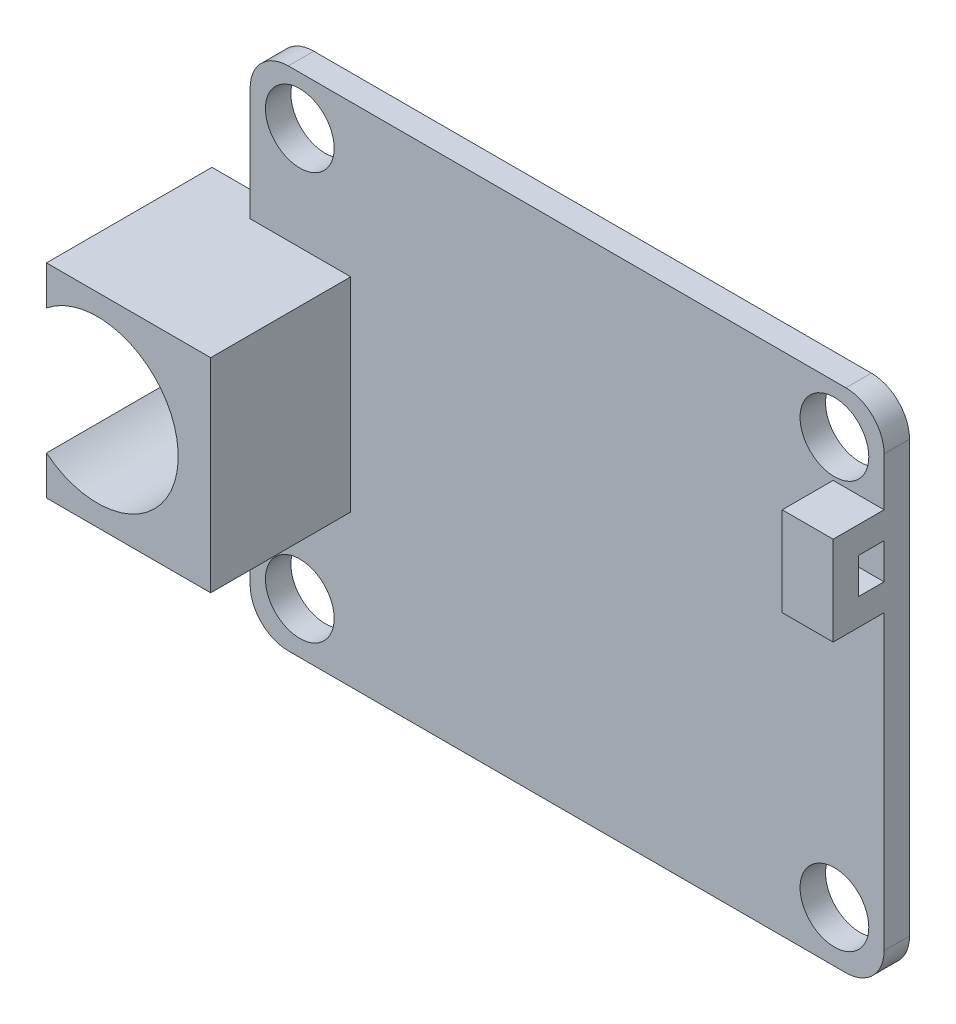
from build123d import *

# Parameters (mm, degrees)
CROQUIS1_W              = 49.8
CROQUIS1_H              = 39.8
CROQUIS1_R              = 2.7
SALIENTE_EXTRUIR1_DEPTH = 6
CORTAR_EXTRUIR1_DEPTH   = 4
REDONDEO1_R             = 3
SALIENTE_EXTRUIR3_DEPTH = 3
CROQUIS5_R              = 6.35
CORTAR_EXTRUIR2_DEPTH   = 3
SALIENTE_EXTRUIR4_DEPTH = 10
SALIENTE_EXTRUIR5_DEPTH = 2
CORTAR_EXTRUIR3_START   = -3
CORTAR_EXTRUIR3_DEPTH   = 3
CORTAR_EXTRUIR4_DEPTH   = 4
CROQUIS10_W             = 4
CROQUIS10_H             = 7
SALIENTE_EXTRUIR6_DEPTH = 4
CORTAR_EXTRUIR5_START   = -4
CORTAR_EXTRUIR5_DEPTH   = 4


with BuildPart() as part:
    # Croquis1 → Saliente-Extruir1 (new body)
    with BuildSketch(Plane.XY):
        with Locations((-31.963412372, -3.757931034)):
            Rectangle(CROQUIS1_W, CROQUIS1_H)
        with Locations((-52.963412372, 12.342068966)):
            Circle(CROQUIS1_R, mode=Mode.SUBTRACT)
        with Locations((-10.963412372, 12.342068966)):
            Circle(CROQUIS1_R, mode=Mode.SUBTRACT)
        with Locations((-10.963412372, -19.657931034)):
            Circle(CROQUIS1_R, mode=Mode.SUBTRACT)
        with Locations((-52.963412372, -19.657931034)):
            Circle(CROQUIS1_R, mode=Mode.SUBTRACT)
    extrude(amount=SALIENTE_EXTRUIR1_DEPTH)

    # Croquis2 → Cortar-Extruir1 (cut)
    with BuildSketch(Plane.XY.offset(6)):
        with BuildLine():
            Line((-49.963412372, -16.757931034), (-13.963412372, -16.757931034))
            ThreePointArc((-13.963412372, -16.757931034), (-12.54919881, -16.172144597), (-11.963412372, -14.757931034))
            Line((-11.963412372, -14.757931034), (-11.963412372, 7.242068966))
            ThreePointArc((-11.963412372, 7.242068966), (-12.54919881, 8.656282528), (-13.963412372, 9.242068966))
            Line((-13.963412372, 9.242068966), (-49.963412372, 9.242068966))
            ThreePointArc((-49.963412372, 9.242068966), (-51.377625934, 8.656282528), (-51.963412372, 7.242068966))
            Line((-51.963412372, 7.242068966), (-51.963412372, -14.757931034))
            ThreePointArc((-51.963412372, -14.757931034), (-51.377625934, -16.172144597), (-49.963412372, -16.757931034))
        make_face()
    extrude(amount=-CORTAR_EXTRUIR1_DEPTH, mode=Mode.SUBTRACT)

    # Redondeo1
    redondeo1_edges = [part.edges().sort_by_distance(p)[0] for p in [
        (-56.863412372, 16.142068966, 3),
        (-7.063412372, 16.142068966, 3),
        (-7.063412372, -23.657931034, 3),
        (-56.863412372, -23.657931034, 3),
    ]]
    fillet(redondeo1_edges, radius=REDONDEO1_R)

    # Croquis4 → Saliente-Extruir3 (add)
    with BuildSketch(Plane(origin=(0, 0, 0), x_dir=(-1, 0, 0), z_dir=(0, 0, -1))):
        with BuildLine():
            Line((56.863412372, 4.242068966), (61.863412372, 4.242068966))
            Line((61.863412372, 4.242068966), (61.863412372, -0.257931034))
            Line((61.863412372, -0.257931034), (57.863412372, -0.257931034))
            ThreePointArc((57.863412372, -0.257931034), (57.358118834, -0.294597605), (56.863412372, -0.403829068))
            Line((56.863412372, -0.403829068), (56.863412372, 4.242068966))
        make_face()
        with BuildLine():
            Line((61.863412372, -11.757931034), (56.863412372, -11.757931034))
            Line((56.863412372, -11.757931034), (56.863412372, -7.112033001))
            ThreePointArc((56.863412372, -7.112033001), (57.358118834, -7.221264464), (57.863412372, -7.257931034))
            Line((57.863412372, -7.257931034), (61.863412372, -7.257931034))
            Line((61.863412372, -7.257931034), (61.863412372, -11.757931034))
        make_face()
    extrude(amount=-SALIENTE_EXTRUIR3_DEPTH)

    # Croquis5 → Cortar-Extruir2 (cut)
    with BuildSketch(Plane.XY.offset(3)):
        with Locations((-57.863412372, -3.757931034)):
            Circle(CROQUIS5_R)
    extrude(amount=CORTAR_EXTRUIR2_DEPTH, mode=Mode.SUBTRACT)

    # Croquis6 → Saliente-Extruir4 (add)
    with BuildSketch(Plane.XY.offset(3)):
        with BuildLine():
            Line((-61.863412372, 4.242068966), (-51.963412372, 4.242068966))
            Line((-51.963412372, 4.242068966), (-48.963412372, 4.242068966))
            Line((-48.963412372, 4.242068966), (-48.963412372, -11.757931034))
            Line((-48.963412372, -11.757931034), (-51.963412372, -11.757931034))
            Line((-51.963412372, -11.757931034), (-61.863412372, -11.757931034))
            Line((-61.863412372, -11.757931034), (-61.863412372, -8.689715701))
            ThreePointArc((-61.863412372, -8.689715701), (-51.513412372, -3.757931034), (-61.863412372, 1.173853632))
            Line((-61.863412372, 1.173853632), (-61.863412372, 4.242068966))
        make_face()
    extrude(amount=SALIENTE_EXTRUIR4_DEPTH)

    # Croquis7 → Saliente-Extruir5 (add)
    with BuildSketch(Plane.XY.offset(2)):
        Polygon((-51.963412372, -3.757931034), (-51.963412372, 4.242068966), (-48.963412372, 4.242068966), (-48.963412372, -11.757931034), (-51.963412372, -11.757931034), align=None)
    extrude(amount=SALIENTE_EXTRUIR5_DEPTH)

    # Croquis8 → Cortar-Extruir3 (cut)
    with BuildSketch(Plane.XY.offset(3).offset(CORTAR_EXTRUIR3_START)):
        with BuildLine():
            Line((-56.863412372, -0.403829068), (-56.863412372, -7.112033001))
            ThreePointArc((-56.863412372, -7.112033001), (-53.509310406, -3.757931034), (-56.863412372, -0.403829068))
        make_face()
    extrude(amount=CORTAR_EXTRUIR3_DEPTH, mode=Mode.SUBTRACT)

    # Croquis9 → Cortar-Extruir4 (cut)
    with BuildSketch(Plane.XY.offset(6)):
        Polygon((-56.863412372, -11.757931034), (-56.863412372, -27.492217147), (-1.817084798, -27.492217147), (-1.817084798, 22.861833321), (-56.863412372, 22.861833321), (-56.863412372, 4.242068966), (-47.172737702, 4.242068966), (-47.172737702, -11.757931034), align=None)
    extrude(amount=-CORTAR_EXTRUIR4_DEPTH, mode=Mode.SUBTRACT)

    # Croquis10 → Saliente-Extruir6 (add)
    with BuildSketch(Plane.XY.offset(2)):
        with Locations((-9.063412372, 5.842068966)):
            Rectangle(CROQUIS10_W, CROQUIS10_H)
    extrude(amount=SALIENTE_EXTRUIR6_DEPTH)

    # Croquis11 → Cortar-Extruir5 (cut)
    with BuildSketch(Plane(origin=(-7.063412372, 0, 0), x_dir=(0, 0, -1), z_dir=(1, 0, 0)).offset(CORTAR_EXTRUIR5_START)):
        Polygon((-2, 5.842068966), (-2, 7.242068966), (-4, 7.242068966), (-4, 4.442068966), (-2, 4.442068966), align=None)
    extrude(amount=CORTAR_EXTRUIR5_DEPTH, mode=Mode.SUBTRACT)


solid = part.part
